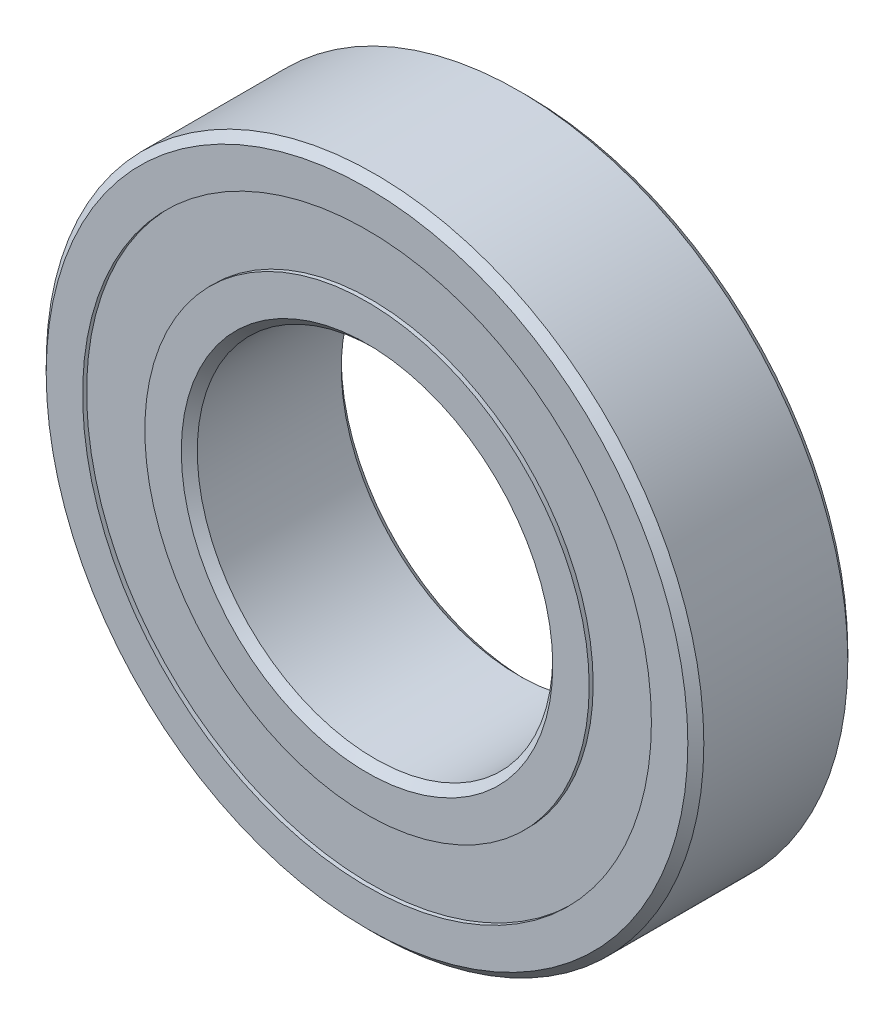
from build123d import *

# Parameters (mm, degrees)
CIRPATTERN1_COUNT = 11
SKETCH5_W         = 1.617463547
SKETCH5_H         = 3.5


with BuildPart() as part:
    # Sketch3 → Revolve1 (revolve)
    with BuildSketch(Plane(origin=(0, 0, 0), x_dir=(0, 0, -1), z_dir=(1, 0, 0)), mode=Mode.PRIVATE) as revolve1_sk:
        with BuildLine():
            Line((-4.5, 18.05), (-4.5, 16))
            Line((-4.5, 16), (-2, 16))
            ThreePointArc((-2, 16), (0, 16.907536453), (2, 16))
            Line((2, 16), (4.5, 16))
            Line((4.5, 16), (4.5, 18.05))
            Line((4.5, 18.05), (4.05, 18.5))
            Line((4.05, 18.5), (-4.05, 18.5))
            Line((-4.05, 18.5), (-4.5, 18.05))
        make_face()
        with BuildLine():
            Line((-4.5, 10.45), (-4.5, 12.5))
            Line((-4.5, 12.5), (-2, 12.5))
            ThreePointArc((-2, 12.5), (0, 11.592463547), (2, 12.5))
            Line((2, 12.5), (4.5, 12.5))
            Line((4.5, 12.5), (4.5, 10.45))
            Line((4.5, 10.45), (4.05, 10))
            Line((4.05, 10), (-4.05, 10))
            Line((-4.05, 10), (-4.5, 10.45))
        make_face()
    revolve(revolve1_sk.sketch.rotate(Axis((0, 0, 4.5), (0, 0, -1)), 90), axis=Axis((0, 0, 4.5), (0, 0, -1)))


with BuildPart() as body_2:
    # Sketch4 → Revolve2 (revolve)
    with BuildSketch(Plane(origin=(0, 0, 0), x_dir=(0, 0, -1), z_dir=(1, 0, 0))):
        with BuildLine():
            Line((-2.657536453, 14.25), (2.657536453, 14.25))
            ThreePointArc((2.657536453, 14.25), (0, 16.907536453), (-2.657536453, 14.25))
        make_face()
    revolve(axis=Axis((0, 14.25, 2.657536453), (0, 0, -1)))


with BuildPart() as cirpattern1_1:
    # CirPattern1: pattern copy
    add(body_2.part.rotate(Axis((0, 0, 0), (0, 0, 1)), 1 * 360 / CIRPATTERN1_COUNT))


with BuildPart() as cirpattern1_2:
    # CirPattern1: pattern copy
    add(body_2.part.rotate(Axis((0, 0, 0), (0, 0, 1)), 2 * 360 / CIRPATTERN1_COUNT))


with BuildPart() as cirpattern1_3:
    # CirPattern1: pattern copy
    add(body_2.part.rotate(Axis((0, 0, 0), (0, 0, 1)), 3 * 360 / CIRPATTERN1_COUNT))


with BuildPart() as cirpattern1_4:
    # CirPattern1: pattern copy
    add(body_2.part.rotate(Axis((0, 0, 0), (0, 0, 1)), 4 * 360 / CIRPATTERN1_COUNT))


with BuildPart() as cirpattern1_5:
    # CirPattern1: pattern copy
    add(body_2.part.rotate(Axis((0, 0, 0), (0, 0, 1)), 5 * 360 / CIRPATTERN1_COUNT))


with BuildPart() as cirpattern1_6:
    # CirPattern1: pattern copy
    add(body_2.part.rotate(Axis((0, 0, 0), (0, 0, 1)), 6 * 360 / CIRPATTERN1_COUNT))


with BuildPart() as cirpattern1_7:
    # CirPattern1: pattern copy
    add(body_2.part.rotate(Axis((0, 0, 0), (0, 0, 1)), 7 * 360 / CIRPATTERN1_COUNT))


with BuildPart() as cirpattern1_8:
    # CirPattern1: pattern copy
    add(body_2.part.rotate(Axis((0, 0, 0), (0, 0, 1)), 8 * 360 / CIRPATTERN1_COUNT))


with BuildPart() as cirpattern1_9:
    # CirPattern1: pattern copy
    add(body_2.part.rotate(Axis((0, 0, 0), (0, 0, 1)), 9 * 360 / CIRPATTERN1_COUNT))


with BuildPart() as cirpattern1_10:
    # CirPattern1: pattern copy
    add(body_2.part.rotate(Axis((0, 0, 0), (0, 0, 1)), 10 * 360 / CIRPATTERN1_COUNT))


with BuildPart() as body_13:
    # Sketch5 → Revolve3 (revolve)
    with BuildSketch(Plane(origin=(0, 0, 0), x_dir=(0, 0, -1), z_dir=(1, 0, 0)), mode=Mode.PRIVATE) as revolve3_sk:
        with Locations((-3.466268227, 14.25)):
            Rectangle(SKETCH5_W, SKETCH5_H)
        with Locations((3.466268227, 14.25)):
            Rectangle(SKETCH5_W, SKETCH5_H)
    revolve(revolve3_sk.sketch.rotate(Axis((0, 0, 4.5), (0, 0, -1)), 90), axis=Axis((0, 0, 4.5), (0, 0, -1)))


solid = Compound([part.part, body_2.part, cirpattern1_1.part, cirpattern1_2.part, cirpattern1_3.part, cirpattern1_4.part, cirpattern1_5.part, cirpattern1_6.part, cirpattern1_7.part, cirpattern1_8.part, cirpattern1_9.part, cirpattern1_10.part, body_13.part])
